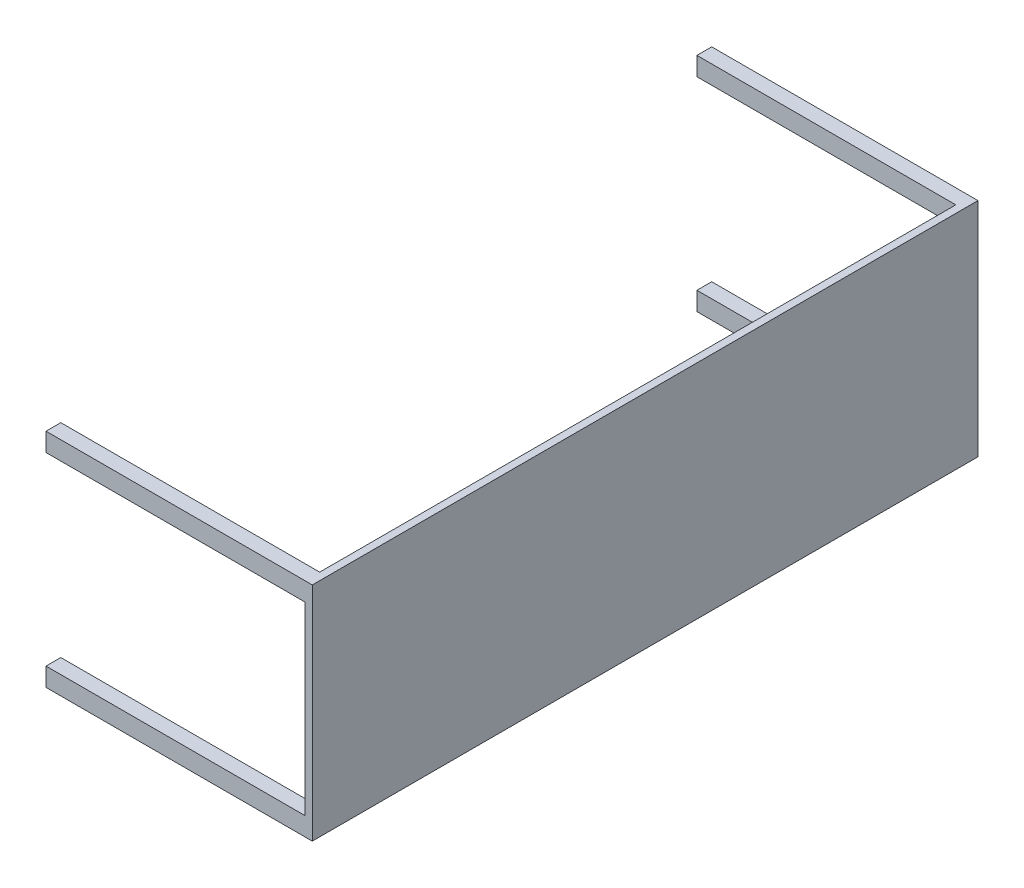
from build123d import *

# Parameters (mm, degrees)
SKETCH_1_W      = 600
SKETCH_1_H      = 1800
EXTRUDE_1_DEPTH = 20
SKETCH_2_W      = 50
SKETCH_2_H      = 40
EXTRUDE_2_DEPTH = 700


with BuildPart() as part:
    # 스케치1 → 보스-돌출1 (new body)
    with BuildSketch(Plane.YZ):
        with Locations((110.745233969, -816.291161179)):
            Rectangle(SKETCH_1_W, SKETCH_1_H)
    extrude(amount=EXTRUDE_1_DEPTH)

    # 스케치2 → 보스-돌출2 (add)
    with BuildSketch(Plane(origin=(0, 0, 0), x_dir=(0, -1, 0), z_dir=(-1, 0, 0))):
        with Locations((-385.745233969, -1696.291161179)):
            Rectangle(SKETCH_2_W, SKETCH_2_H)
        with Locations((-385.745233969, 63.708838821)):
            Rectangle(SKETCH_2_W, SKETCH_2_H)
        with Locations((164.254766031, 63.708838821)):
            Rectangle(SKETCH_2_W, SKETCH_2_H)
        with Locations((164.254766031, -1696.291161179)):
            Rectangle(SKETCH_2_W, SKETCH_2_H)
    extrude(amount=EXTRUDE_2_DEPTH)


solid = part.part
